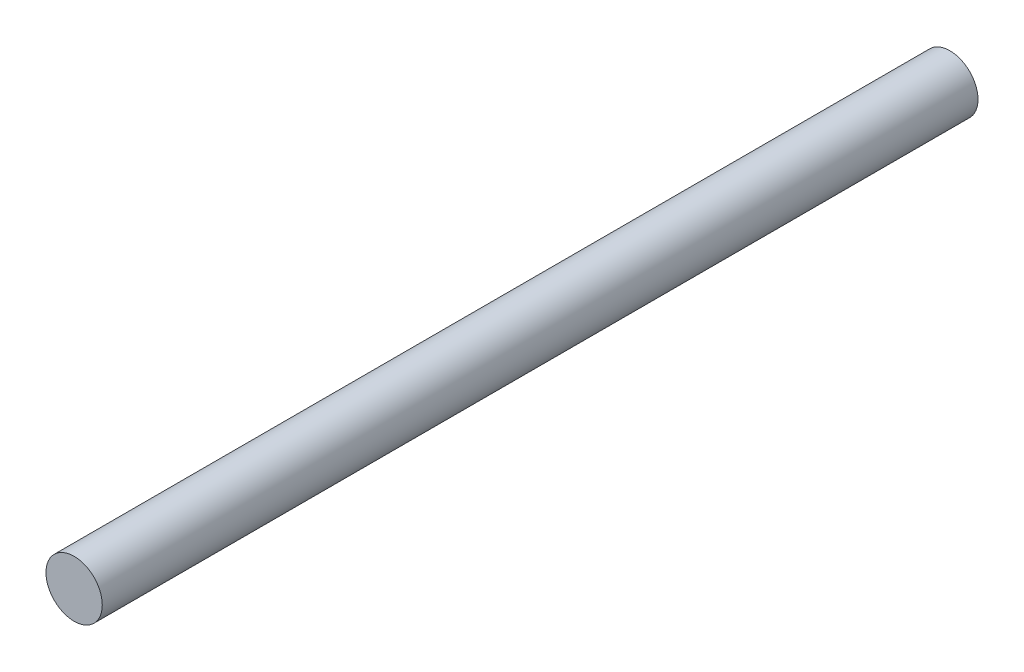
from build123d import *

# Parameters (mm, degrees)
BOSS_EXTRUDE1_DEPTH      = 143.2
BOSS_EXTRUDE1_DEPTH_BACK = 133.2
SKETCH1_R                = 8.89


with BuildPart() as part:
    # Sketch1 → Boss-Extrude1 (new, two sides: drawn at the far end of the back side and taken through both)
    with BuildSketch(Plane.XY.offset(-BOSS_EXTRUDE1_DEPTH_BACK)):
        Circle(SKETCH1_R)
    extrude(amount=BOSS_EXTRUDE1_DEPTH + BOSS_EXTRUDE1_DEPTH_BACK)


solid = part.part
